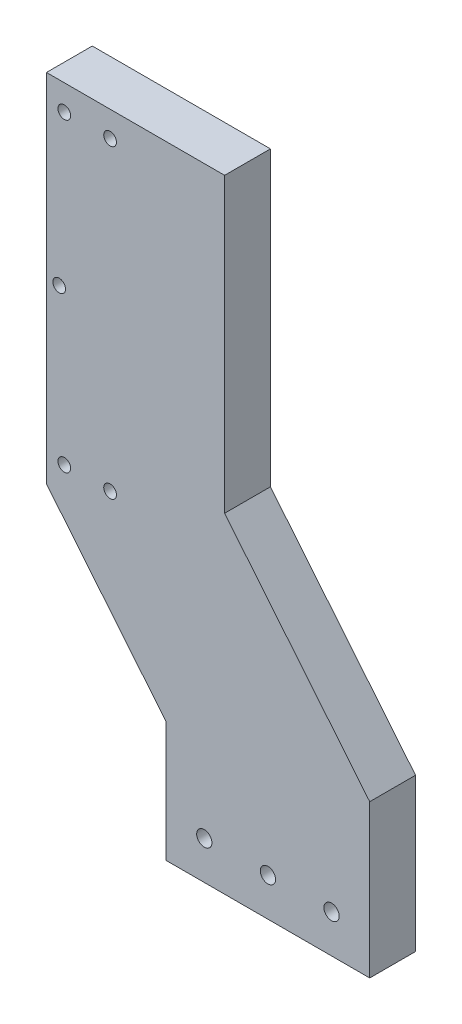
from build123d import *

# Parameters (mm, degrees)
EXTRUDE_1_DEPTH     = 18
HOLE_WIZARD_M6_1_D  = 5
SKETCH_7_R          = 3
CUT_EXTRUDE_1_DEPTH = 259.015029546
HOLE_WIZARD_M6_2_D  = 5


with BuildPart() as part:
    # 草图1 → 凸台-拉伸1 (new body)
    with BuildSketch(Plane.XY):
        Polygon((0, 0), (80, 0), (80, 60), (22.986425339, 129.63800905), (22.986425339, 244.63800905), (-47.013574661, 244.63800905), (-47.013574661, 104.63800905), (0, 47.214285714), align=None)
    extrude(amount=EXTRUDE_1_DEPTH)

    # M6 螺纹孔1 (through all)
    with Locations(Plane.XY.offset(18)):
        with Locations((-40.013574661, 114.63800905), (-22.013574661, 114.63800905), (-40.013574661, 234.63800905), (-22.013574661, 234.63800905)):
            Hole(HOLE_WIZARD_M6_1_D / 2)

    # 草图7 → 切除-拉伸1 (cut, through all)
    with BuildSketch(Plane.XY.offset(18)):
        with Locations((15, 15)):
            Circle(SKETCH_7_R)
        with Locations((40, 15)):
            Circle(SKETCH_7_R)
        with Locations((65, 15)):
            Circle(SKETCH_7_R)
    extrude(amount=-CUT_EXTRUDE_1_DEPTH, mode=Mode.SUBTRACT)

    # M6 螺纹孔2 (through all)
    with Locations(Plane(origin=(-42.013574661, 174.63800905, 18), x_dir=(1, 0, 0), z_dir=(0, 0, 1))):
        with Locations((0, 0)):
            Hole(HOLE_WIZARD_M6_2_D / 2)


solid = part.part
